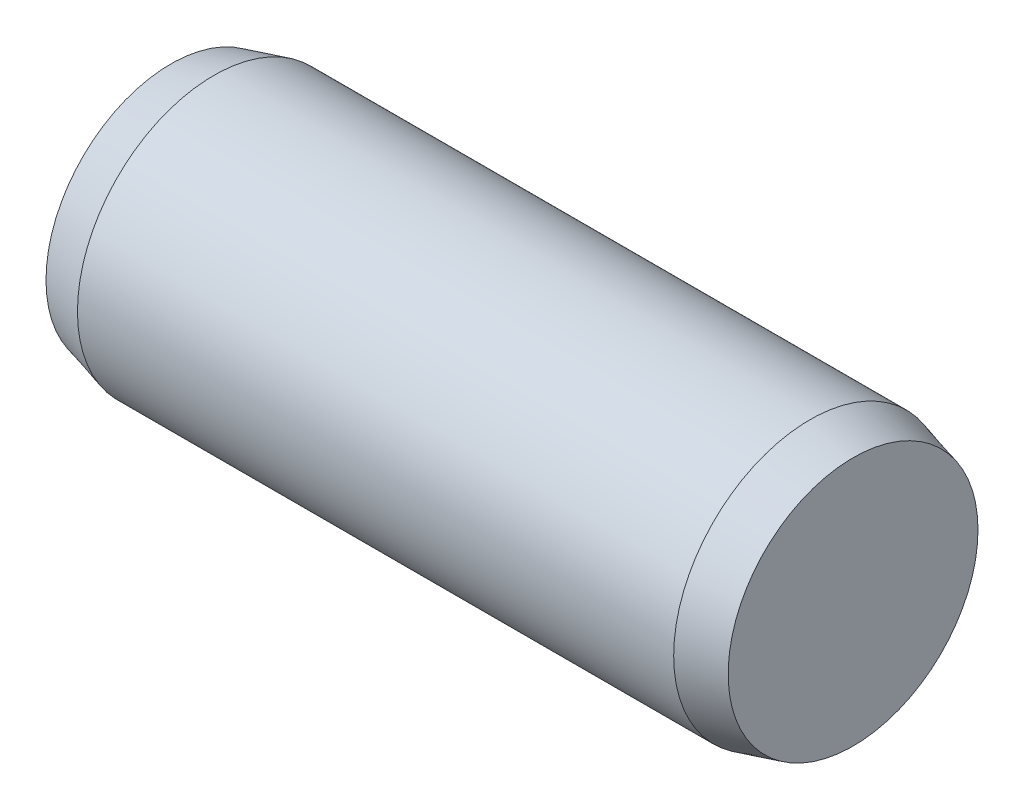
from build123d import *

# Parameters (mm, degrees)
EXTRUDE1_DEPTH      = 4.37
EXTRUDE1_DEPTH_BACK = 4.37
SKETCH2_R           = 2
SKETCH3_R           = 2
EXTRUDE2_DEPTH      = 0.63
EXTRUDE2_TAPER      = 15
SKETCH4_R           = 2
EXTRUDE3_DEPTH      = 0.63
EXTRUDE3_TAPER      = 15


with BuildPart() as part:
    # Sketch2 → Extrude1 (new, two sides: drawn at the far end of the back side and taken through both)
    with BuildSketch(Plane(origin=(0, 0, 0), x_dir=(0, 0, -1), z_dir=(1, 0, 0)).offset(-EXTRUDE1_DEPTH_BACK)):
        Circle(SKETCH2_R)
    extrude(amount=EXTRUDE1_DEPTH + EXTRUDE1_DEPTH_BACK)

    # Sketch3 → Extrude2 (add)
    with BuildSketch(Plane(origin=(4.37, 0, 0), x_dir=(0, 0, -1), z_dir=(1, 0, 0))):
        Circle(SKETCH3_R)
    extrude(amount=EXTRUDE2_DEPTH, taper=EXTRUDE2_TAPER)

    # Sketch4 → Extrude3 (add)
    with BuildSketch(Plane.ZY.offset(4.37)):
        with Locations(Location((0, 0, 0), (0, 0, 180))):
            Circle(SKETCH4_R)
    extrude(amount=EXTRUDE3_DEPTH, taper=EXTRUDE3_TAPER)


solid = part.part
